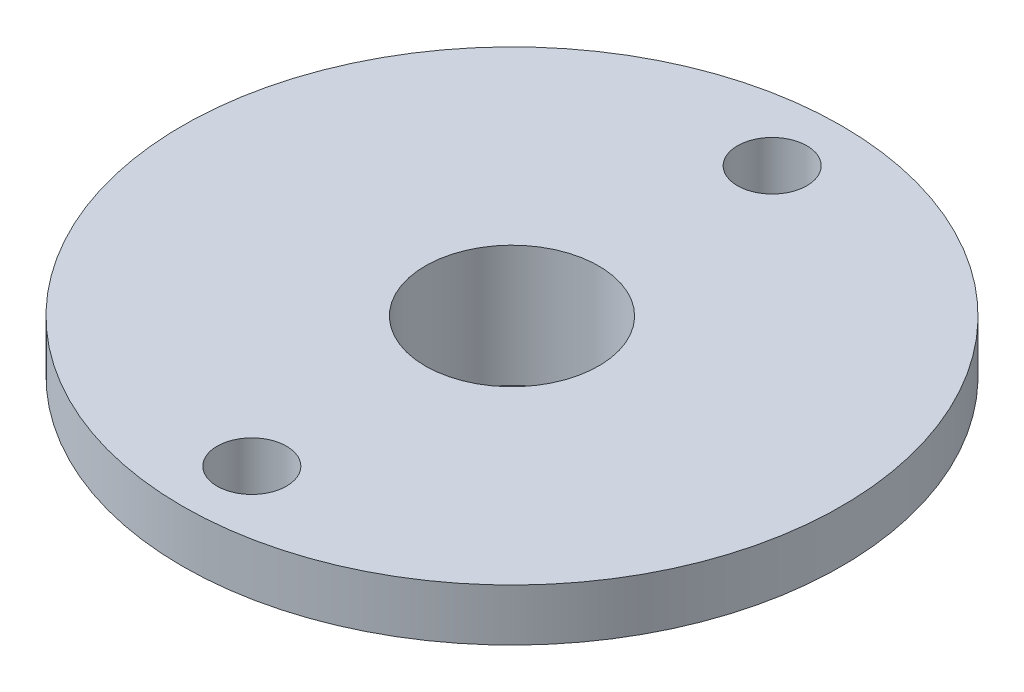
from build123d import *

# Parameters (mm, degrees)
ESQUISSE1_R      = 5
EXTRUSION1_DEPTH = 2
ESQUISSE2_R      = 9.5
EXTRUSION2_DEPTH = 1.5
ESQUISSE3_R      = 2.5
ESQUISSE3_R_2    = 1
EXTRUSION3_DEPTH = 14.883443377


with BuildPart() as part:
    # Esquisse1 → Extrusion1 (new body)
    with BuildSketch(Plane(origin=(0, 0, 0), x_dir=(1, 0, 0), z_dir=(0, 1, 0))):
        with Locations(Location((0, 0, 0), (0, 0, 270))):
            Circle(ESQUISSE1_R)
    extrude(amount=EXTRUSION1_DEPTH)

    # Esquisse2 → Extrusion2 (add)
    with BuildSketch(Plane(origin=(0, 2, 0), x_dir=(-1, 0, 0), z_dir=(0, 1, 0))):
        with Locations(Location((0, 0, 0), (0, 0, 90))):
            Circle(ESQUISSE2_R)
    extrude(amount=EXTRUSION2_DEPTH)

    # Esquisse3 → Extrusion3 (cut, through all)
    with BuildSketch(Plane(origin=(0, 3.5, 0), x_dir=(-1, 0, 0), z_dir=(0, 1, 0))):
        with Locations(Location((0, 0, 0), (0, 0, 90))):
            Circle(ESQUISSE3_R)
        with Locations(Location((0, -7.5, 0), (0, 0, 90))):
            Circle(ESQUISSE3_R_2)
        with Locations(Location((0, 7.5, 0), (0, 0, 90))):
            Circle(ESQUISSE3_R_2)
    extrude(amount=-EXTRUSION3_DEPTH, mode=Mode.SUBTRACT)


solid = part.part
